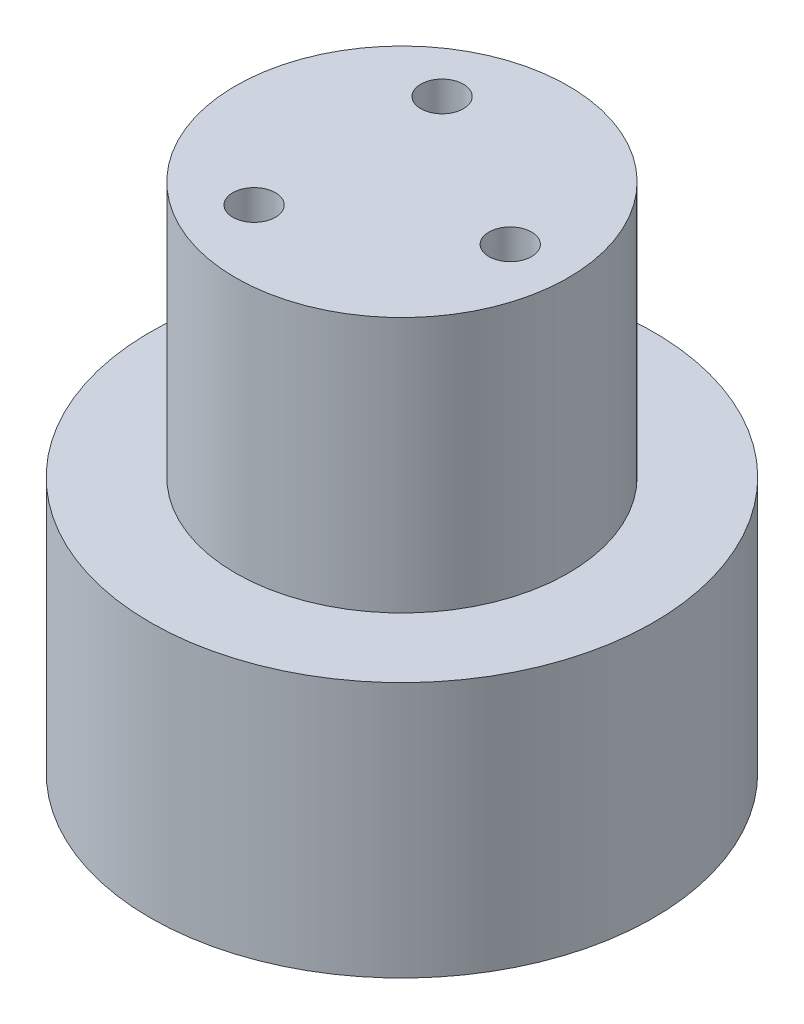
from build123d import *

# Parameters (mm, degrees)
SKETCH_1_R          = 2.95
EXTRUDE_1_DEPTH     = 3
SKETCH_2_R          = 1.95
EXTRUDE_2_DEPTH     = 3
SKETCH_3_R          = 0.25
CUT_EXTRUDE_1_DEPTH = 6


with BuildPart() as part:
    # Эскиз1 → Бобышка-Вытянуть1 (new body)
    with BuildSketch(Plane(origin=(0, 0, 0), x_dir=(1, 0, 0), z_dir=(0, 1, 0))):
        with Locations(Location((0, 0, 0), (0, 0, 270))):
            Circle(SKETCH_1_R)
    extrude(amount=-EXTRUDE_1_DEPTH)

    # Эскиз2 → Бобышка-Вытянуть2 (add)
    with BuildSketch(Plane(origin=(0, 0, 0), x_dir=(1, 0, 0), z_dir=(0, 1, 0))):
        with Locations(Location((0, 0, 0), (0, 0, 270))):
            Circle(SKETCH_2_R)
    extrude(amount=EXTRUDE_2_DEPTH)

    # Эскиз3 → Вырез-Вытянуть1 (cut)
    with BuildSketch(Plane.XZ.offset(3)):
        with Locations(Location((1.27, 0, 0), (0, 0, 270))):
            Circle(SKETCH_3_R)
        with Locations(Location((-0.630957819, 1.102176134, 0), (0, 0, 270))):
            Circle(SKETCH_3_R)
        with Locations(Location((-0.630957819, -1.102176134, 0), (0, 0, 270))):
            Circle(SKETCH_3_R)
    extrude(amount=-CUT_EXTRUDE_1_DEPTH, mode=Mode.SUBTRACT)


solid = part.part
